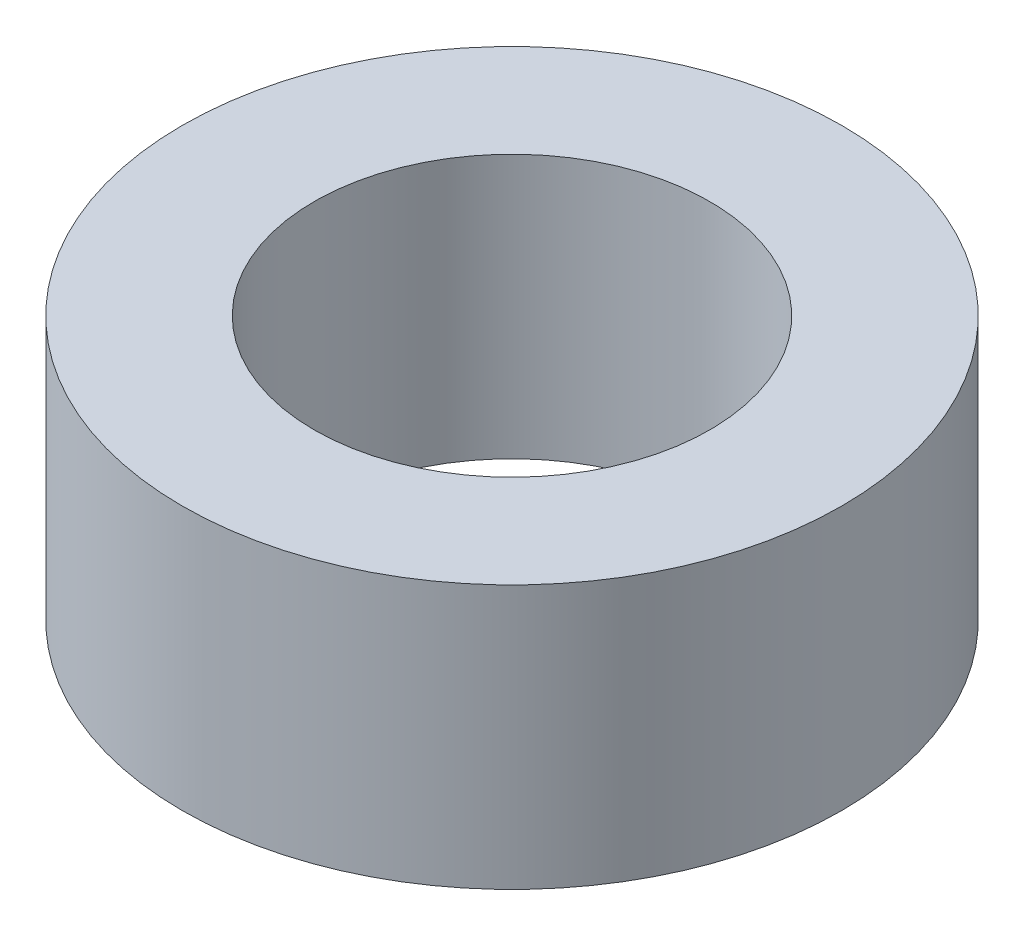
from build123d import *

# Parameters (mm, degrees)
SKETCH_1_R      = 2.5
SKETCH_1_R_2    = 1.5
EXTRUDE_1_DEPTH = 2


with BuildPart() as part:
    # Эскиз1 → Бобышка-Вытянуть1 (new body)
    with BuildSketch(Plane(origin=(0, 0, 0), x_dir=(1, 0, 0), z_dir=(0, 1, 0))):
        with Locations(Location((0, 0, 0), (0, 0, 270))):
            Circle(SKETCH_1_R)
        with Locations(Location((0, 0, 0), (0, 0, 270))):
            Circle(SKETCH_1_R_2, mode=Mode.SUBTRACT)
    extrude(amount=EXTRUDE_1_DEPTH)


solid = part.part
